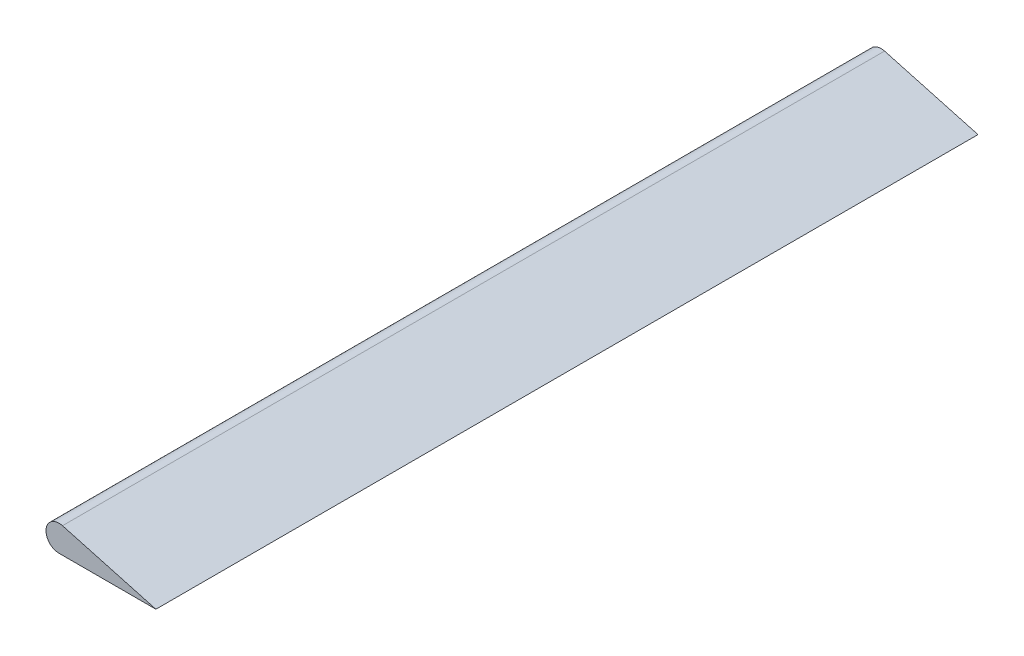
from build123d import *

# Parameters (mm, degrees)
BOSS_EXTRUDE1_DEPTH = 238
SKETCH3_W           = 15
SKETCH3_H           = 15
CUT_EXTRUDE1_DEPTH  = 54


with BuildPart() as part:
    # Sketch2 → Boss-Extrude1 (new body)
    with BuildSketch(Plane.XY.offset(-3)):
        with BuildLine():
            Line((446.391965645, 20.11245238), (474.43313548, 20.11245238))
            Line((474.43313548, 20.11245238), (447.390900992, 27.530319971))
            ThreePointArc((447.390900992, 27.530319971), (442.649552271, 24.39262378), (446.391965645, 20.11245238))
        make_face()
    extrude(amount=BOSS_EXTRUDE1_DEPTH)

    # Sketch3 → Cut-Extrude1 (cut)
    with BuildSketch(Plane.XZ.offset(30.589717262)):
        with Locations((450.115770482, 182.5)):
            Rectangle(SKETCH3_W, SKETCH3_H)
        with Locations((450.115770482, 49.5)):
            Rectangle(SKETCH3_W, SKETCH3_H)
    extrude(amount=-CUT_EXTRUDE1_DEPTH, mode=Mode.SUBTRACT)


solid = part.part
